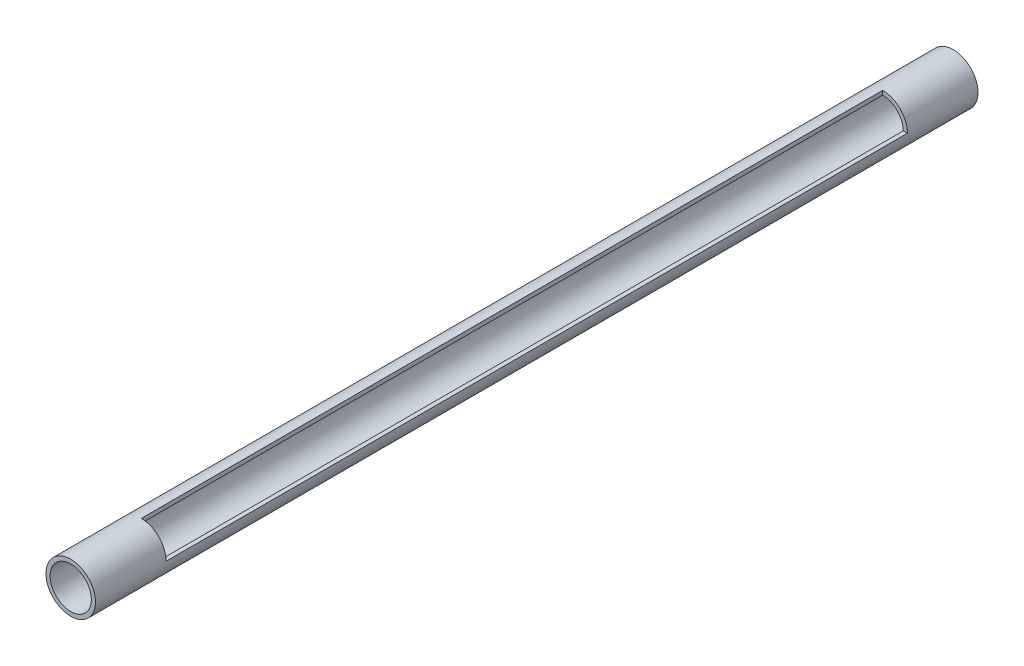
from build123d import *

# Parameters (mm, degrees)
SKIZZE1_R                       = 21.035
SKIZZE1_R_2                     = 17.525
AUFSATZ_LINEAR_AUSTRAGEN1_DEPTH = 375
SKIZZE2_W                       = 50
SKIZZE2_H                       = 630
SCHNITT_LINEAR_AUSTRAGEN1_DEPTH = 377.178072793


with BuildPart() as part:
    # Skizze1 → Aufsatz-Linear austragen1 (new, symmetric)
    with BuildSketch(Plane.XY):
        Circle(SKIZZE1_R)
        Circle(SKIZZE1_R_2, mode=Mode.SUBTRACT)
    extrude(amount=AUFSATZ_LINEAR_AUSTRAGEN1_DEPTH, both=True)

    # Skizze2 → Schnitt-Linear austragen1 (cut, through all)
    with BuildSketch(Plane(origin=(0, 0, 0), x_dir=(1, 0, 0), z_dir=(0, 1, 0))):
        with Locations((25, 0)):
            Rectangle(SKIZZE2_W, SKIZZE2_H)
    extrude(amount=SCHNITT_LINEAR_AUSTRAGEN1_DEPTH, mode=Mode.SUBTRACT)


solid = part.part
